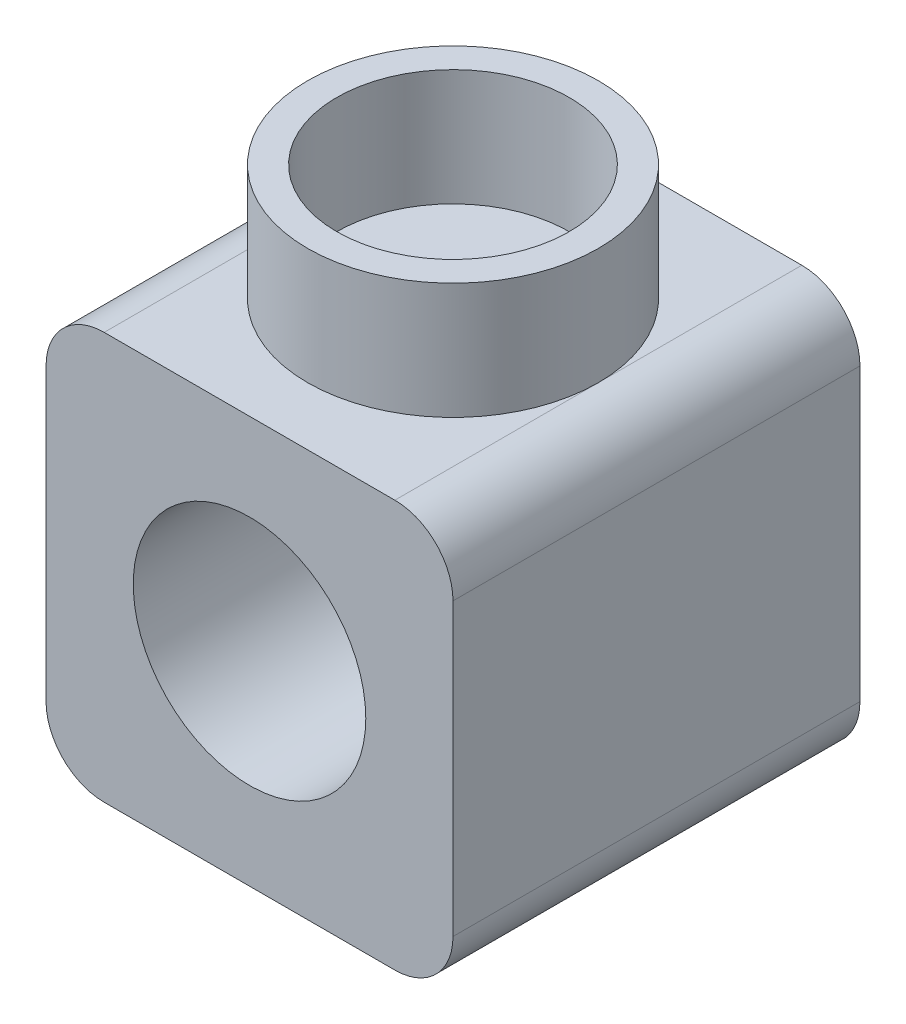
from build123d import *

# Parameters (mm, degrees)
SKETCH1_R           = 100
BOSS_EXTRUDE1_DEPTH = 350
SKETCH2_R           = 125
SKETCH2_R_2         = 100
BOSS_EXTRUDE2_DEPTH = 100


with BuildPart() as part:
    # Sketch1 → Boss-Extrude1 (new body)
    with BuildSketch(Plane.XY):
        with BuildLine():
            Line((-125, 175), (125, 175))
            ThreePointArc((125, 175), (160.355339059, 160.355339059), (175, 125))
            Line((175, 125), (175, -125))
            ThreePointArc((175, -125), (160.355339059, -160.355339059), (125, -175))
            Line((125, -175), (-125, -175))
            ThreePointArc((-125, -175), (-160.355339059, -160.355339059), (-175, -125))
            Line((-175, -125), (-175, 125))
            ThreePointArc((-175, 125), (-160.355339059, 160.355339059), (-125, 175))
        make_face()
        Circle(SKETCH1_R, mode=Mode.SUBTRACT)
    extrude(amount=BOSS_EXTRUDE1_DEPTH)

    # Sketch2 → Boss-Extrude2 (add)
    with BuildSketch(Plane(origin=(0, 175, 0), x_dir=(1, 0, 0), z_dir=(0, 1, 0))):
        with Locations(Location((0, -175, 0), (0, 0, 180))):
            Circle(SKETCH2_R)
        with Locations(Location((0, -175, 0), (0, 0, 270))):
            Circle(SKETCH2_R_2, mode=Mode.SUBTRACT)
    extrude(amount=BOSS_EXTRUDE2_DEPTH)


solid = part.part
